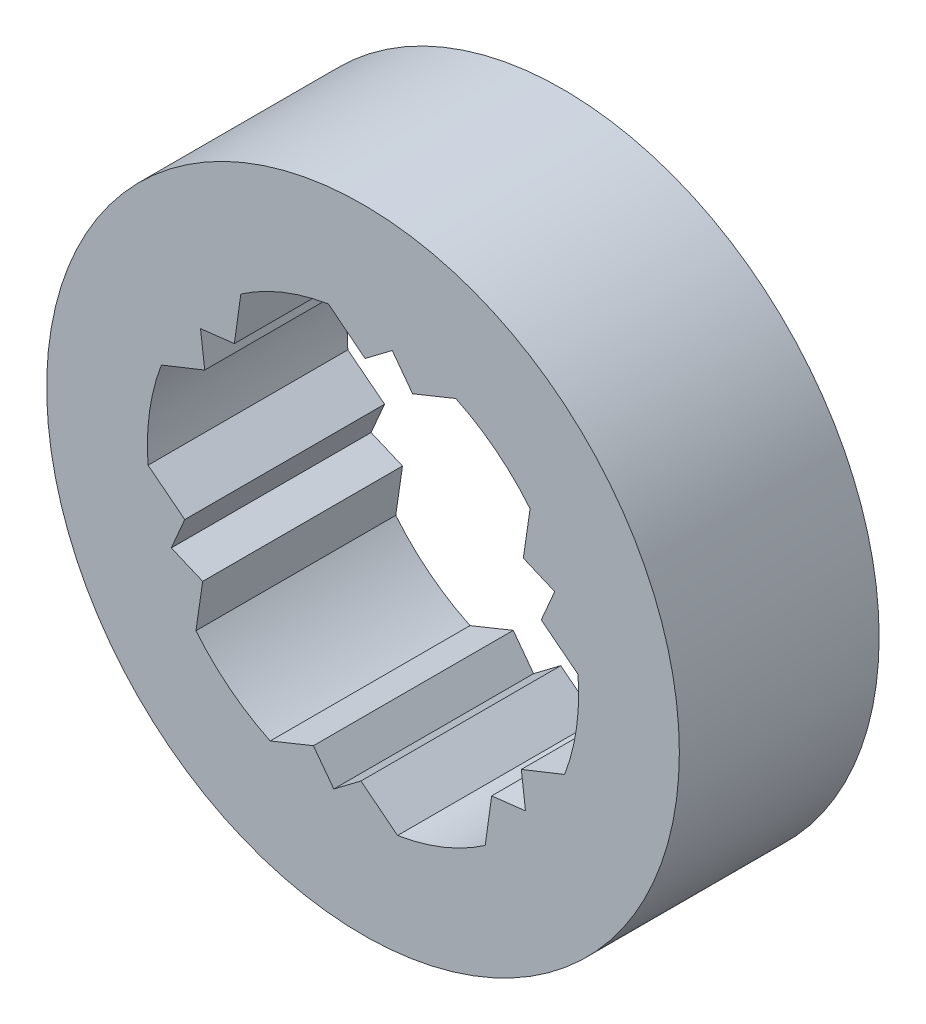
from build123d import *

# Parameters (mm, degrees)
SKETCH5_R           = 4.75
BOSS_EXTRUDE1_DEPTH = 3


with BuildPart() as part:
    # Sketch5 → Boss-Extrude1 (new body)
    with BuildSketch(Plane.XY):
        with Locations((-6.126935789, 33.595569574)):
            Circle(SKETCH5_R)
        with BuildLine():
            Line((-6.157476241, 30.83324102), (-5.608199069, 30.399311777))
            ThreePointArc((-5.608199069, 30.399311777), (-4.920925769, 30.590458674), (-4.292184426, 30.927454297))
            Line((-4.292184426, 30.927454297), (-4.195269897, 31.620712961))
            Line((-4.195269897, 31.620712961), (-3.687251853, 31.680312683))
            Line((-3.687251853, 31.680312683), (-3.749959313, 32.187956489))
            Line((-3.749959313, 32.187956489), (-3.099526979, 32.446679853))
            ThreePointArc((-3.099526979, 32.446679853), (-2.921428398, 33.137449439), (-2.898904497, 33.850453225))
            Line((-2.898904497, 33.850453225), (-3.450826846, 34.281013001))
            Line((-3.450826846, 34.281013001), (-3.248432698, 34.750769394))
            Line((-3.248432698, 34.750769394), (-3.719418861, 34.950285044))
            Line((-3.719418861, 34.950285044), (-3.618263699, 35.64293765))
            ThreePointArc((-3.618263699, 35.64293765), (-4.127438418, 36.142560339), (-4.73365586, 36.518568502))
            Line((-4.73365586, 36.518568502), (-5.382492738, 36.255869615))
            Line((-5.382492738, 36.255869615), (-5.688116634, 36.666026285))
            Line((-5.688116634, 36.666026285), (-6.096395336, 36.357898129))
            Line((-6.096395336, 36.357898129), (-6.645672508, 36.791827372))
            ThreePointArc((-6.645672508, 36.791827372), (-7.332945809, 36.600680475), (-7.961687151, 36.263684851))
            Line((-7.961687151, 36.263684851), (-8.05860168, 35.570426188))
            Line((-8.05860168, 35.570426188), (-8.566619724, 35.510826466))
            Line((-8.566619724, 35.510826466), (-8.503912264, 35.00318266))
            Line((-8.503912264, 35.00318266), (-9.154344598, 34.744459296))
            ThreePointArc((-9.154344598, 34.744459296), (-9.33244318, 34.05368971), (-9.35496708, 33.340685924))
            Line((-9.35496708, 33.340685924), (-8.803044731, 32.910126148))
            Line((-8.803044731, 32.910126148), (-9.005438879, 32.440369755))
            Line((-9.005438879, 32.440369755), (-8.534452717, 32.240854105))
            Line((-8.534452717, 32.240854105), (-8.635607878, 31.548201498))
            ThreePointArc((-8.635607878, 31.548201498), (-8.12643316, 31.04857881), (-7.520215718, 30.672570647))
            Line((-7.520215718, 30.672570647), (-6.871378839, 30.935269534))
            Line((-6.871378839, 30.935269534), (-6.565754944, 30.525112863))
            Line((-6.565754944, 30.525112863), (-6.157476241, 30.83324102))
        make_face(mode=Mode.SUBTRACT)
    extrude(amount=BOSS_EXTRUDE1_DEPTH)


solid = part.part
